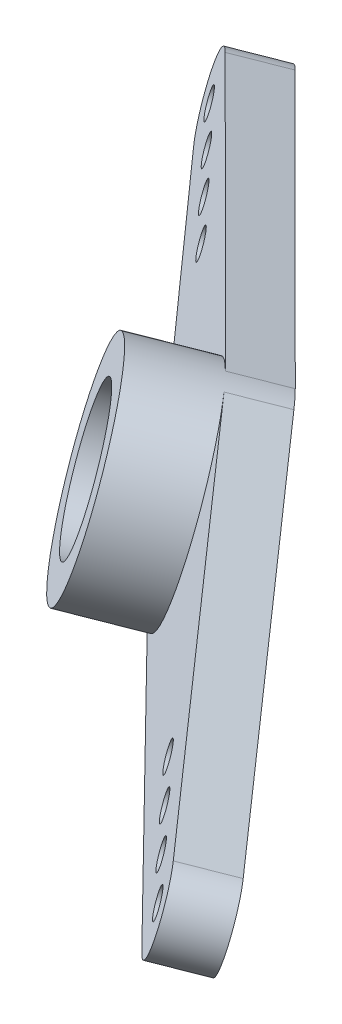
from build123d import *
from build123d.topology import SkipClean

# Parameters (mm, degrees)
SKETCH1_R           = 1.134023506
SKETCH1_R_2         = 0.399750463
BOSS_EXTRUDE1_DEPTH = 1.4986
SKETCH2_R           = 2.9591
BOSS_EXTRUDE2_DEPTH = 2.159
SKETCH3_R           = 1.9812
CUT_EXTRUDE1_DEPTH  = 2.54


with BuildPart() as part:
    # Sketch1 → Boss-Extrude1 (new body)
    with BuildSketch(Plane(origin=(-26.118953855, 9.878989701, 23.95417966), x_dir=(0.6811926509137779, 0.027031276316117844, 0.7316050043854141), z_dir=(-0.7099227615957759, 0.26851456951758673, 0.6510834036627045))):
        with BuildLine():
            Line((-10.17960006, -104.330094763), (4.464711493, -106.277674051))
            ThreePointArc((4.464711493, -106.277674051), (5.521063626, -107.502012677), (4.428867403, -108.694485866))
            Line((4.428867403, -108.694485866), (-10.26676012, -110.206920218))
            ThreePointArc((-10.26676012, -110.206920218), (-10.569702558, -110.222468165), (-10.872644997, -110.206920218))
            Line((-10.872644997, -110.206920218), (-25.56827252, -108.694485866))
            ThreePointArc((-25.56827252, -108.694485866), (-26.660468742, -107.502012677), (-25.60411661, -106.277674051))
            Line((-25.60411661, -106.277674051), (-10.959805057, -104.330094763))
            ThreePointArc((-10.959805057, -104.330094763), (-10.569702558, -104.304268165), (-10.17960006, -104.330094763))
        make_face()
        with Locations(Location((-10.569702558, -107.263368165, 0), (0, 0, 358.39196451))):
            Circle(SKETCH1_R, mode=Mode.SUBTRACT)
        with Locations(Location((4.304284008, -107.48396644, 0), (0, 0, 358.39196451))):
            Circle(SKETCH1_R_2, mode=Mode.SUBTRACT)
        with Locations(Location((2.526284008, -107.457596661, 0), (0, 0, 358.39196451))):
            Circle(SKETCH1_R_2, mode=Mode.SUBTRACT)
        with Locations(Location((0.748284008, -107.431226882, 0), (0, 0, 358.39196451))):
            Circle(SKETCH1_R_2, mode=Mode.SUBTRACT)
        with Locations(Location((-1.029715992, -107.404857104, 0), (0, 0, 358.39196451))):
            Circle(SKETCH1_R_2, mode=Mode.SUBTRACT)
        with Locations(Location((-20.109689125, -107.404857104, 0), (0, 0, 178.39196451))):
            Circle(SKETCH1_R_2, mode=Mode.SUBTRACT)
        with Locations(Location((-21.887689125, -107.431226882, 0), (0, 0, 178.39196451))):
            Circle(SKETCH1_R_2, mode=Mode.SUBTRACT)
        with Locations(Location((-23.665689125, -107.457596661, 0), (0, 0, 178.39196451))):
            Circle(SKETCH1_R_2, mode=Mode.SUBTRACT)
        with Locations(Location((-25.443689125, -107.48396644, 0), (0, 0, 178.39196451))):
            Circle(SKETCH1_R_2, mode=Mode.SUBTRACT)
    extrude(amount=BOSS_EXTRUDE1_DEPTH)

    # Sketch2 → Boss-Extrude2 (add)
    with SkipClean():  # the faces are left unmerged after this step: merging them gives an invalid solid
        with BuildSketch(Plane(origin=(-27.182844105, 10.281385635, 24.929893249), x_dir=(0.681192650913778, 0.027031276316117795, 0.731605004385414), z_dir=(-0.7099227615957758, 0.2685145695175868, 0.6510834036627047))):
            with Locations(Location((-10.569702558, -107.263368165, 0), (0, 0, 97.575438716))):
                Circle(SKETCH2_R)
        extrude(amount=BOSS_EXTRUDE2_DEPTH)

    # Sketch3 → Cut-Extrude1 (cut)
    with SkipClean():  # the faces are left unmerged after this step: merging them gives an invalid solid
        with BuildSketch(Plane(origin=(-28.715567348, 10.861108591, 26.335582317), x_dir=(0.6811926509137781, 0.02703127631611777, 0.731605004385414), z_dir=(-0.7099227615957758, 0.26851456951758684, 0.6510834036627048))):
            with Locations(Location((-10.569702558, -107.263368165, 0), (0, 0, 358.39196451))):
                Circle(SKETCH3_R)
        extrude(amount=-CUT_EXTRUDE1_DEPTH, mode=Mode.SUBTRACT)


solid = part.part
